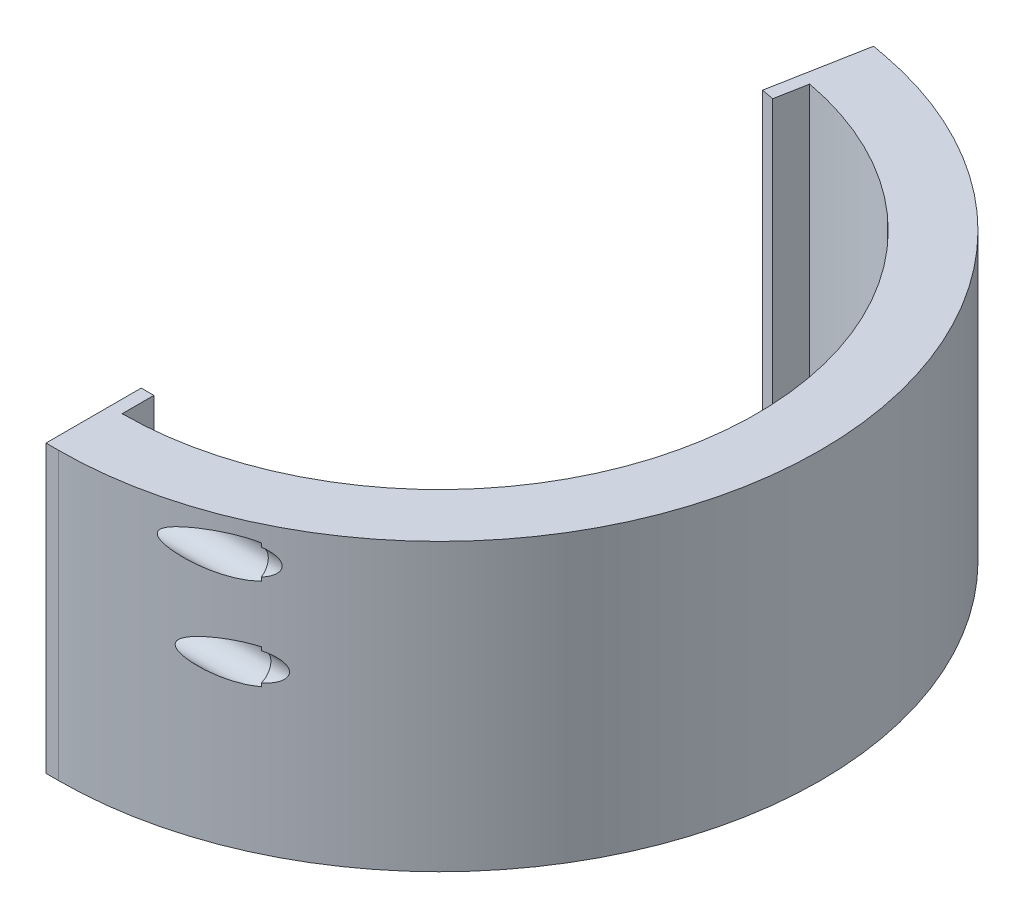
from build123d import *

# Parameters (mm, degrees)
BOSS_EXTRUDE1_DEPTH     = 27.94
CUT_EXTRUDE1_DEPTH      = 62.500004065
CUT_EXTRUDE1_DEPTH_BACK = 62.500004065
SKETCH2_R               = 1.5
SKETCH2_R_2             = 1.554918768
SKETCH2_R_3             = 1.519223358
SKETCH2_3_R             = 1.8175
SKETCH2_3_R_2           = 1.5
SKETCH2_3_R_3           = 1.872418768
SKETCH2_3_R_4           = 1.554918768
SKETCH2_3_R_5           = 1.836723358
SKETCH2_3_R_6           = 1.519223358
CUT_EXTRUDE2_DEPTH      = 17.78
BOSS_EXTRUDE2_START     = -0.6858
BOSS_EXTRUDE2_DEPTH     = 0.6858


with BuildPart() as part:
    # Sketch1 → Boss-Extrude1 (new body)
    with BuildSketch(Plane(origin=(0, 0, 0), x_dir=(1, 0, 0), z_dir=(0, 1, 0))):
        with BuildLine():
            ThreePointArc((63.210725521, -38.1), (101.148320659, -3.514096627), (70.208960434, 37.451765087))
            Line((70.208960434, 37.451765087), (68.960568265, 37.685039584))
            Line((68.960568265, 37.685039584), (67.211009536, 28.322098312))
            Line((67.211009536, 28.322098312), (68.459401706, 28.088823815))
            Line((68.459401706, 28.088823815), (69.042587949, 31.209804239))
            ThreePointArc((69.042587949, 31.209804239), (72.134335795, 30.470176889), (75.136623327, 29.425082184))
            ThreePointArc((75.136623327, 29.425082184), (94.374076266, -6.075201259), (63.210725521, -31.75))
            Line((63.210725521, -31.75), (63.210725521, -28.575))
            Line((63.210725521, -28.575), (61.940725521, -28.575))
            Line((61.940725521, -28.575), (61.940725521, -38.1))
            Line((61.940725521, -38.1), (63.210725521, -38.1))
        make_face()
    extrude(amount=BOSS_EXTRUDE1_DEPTH)

    # Sketch2 → Cut-Extrude1 (cut, two sides: drawn at the far end of the back side and taken through both)
    with BuildSketch(Plane.ZY.offset(-61.940725521).offset(-CUT_EXTRUDE1_DEPTH_BACK)):
        with Locations((34.877492102, 15.559033415)):
            Circle(SKETCH2_R)
        with Locations((35.191543991, 24.633934205)):
            Circle(SKETCH2_R_2)
        with Locations((-35.170796856, 24.633934205)):
            Circle(SKETCH2_R_3)
        with Locations((-35.170796856, 15.364007333)):
            Circle(SKETCH2_R)
    extrude(amount=CUT_EXTRUDE1_DEPTH + CUT_EXTRUDE1_DEPTH_BACK, mode=Mode.SUBTRACT)

    # Sketch2<3> → Cut-Extrude2 (cut)
    # profile 1 of 4: a face of its own
    with BuildSketch(Plane.ZY.offset(-61.940725521)):
        with Locations((34.877492102, 15.559033415)):
            Circle(SKETCH2_3_R)
        with Locations((34.877492102, 15.559033415)):
            Circle(SKETCH2_3_R_2, mode=Mode.SUBTRACT)
    # profile 2 of 4: a face of its own
    with BuildSketch(Plane.ZY.offset(-61.940725521)):
        with Locations((35.191543991, 24.633934205)):
            Circle(SKETCH2_3_R_3)
        with Locations((35.191543991, 24.633934205)):
            Circle(SKETCH2_3_R_4, mode=Mode.SUBTRACT)
    # profile 3 of 4: a face of its own
    with BuildSketch(Plane.ZY.offset(-61.940725521)):
        with Locations((-35.170796856, 24.633934205)):
            Circle(SKETCH2_3_R_5)
        with Locations((-35.170796856, 24.633934205)):
            Circle(SKETCH2_3_R_6, mode=Mode.SUBTRACT)
    # profile 4 of 4: a face of its own
    with BuildSketch(Plane.ZY.offset(-61.940725521)):
        with Locations((-35.170796856, 15.364007333)):
            Circle(SKETCH2_3_R)
        with Locations((-35.170796856, 15.364007333)):
            Circle(SKETCH2_3_R_2, mode=Mode.SUBTRACT)
    extrude(amount=-CUT_EXTRUDE2_DEPTH, mode=Mode.SUBTRACT)

    # Sketch1<2> → Boss-Extrude2 (add)
    with BuildSketch(Plane(origin=(0, 0, 0), x_dir=(1, 0, 0), z_dir=(0, 1, 0)).offset(BOSS_EXTRUDE2_START)):
        with BuildLine():
            ThreePointArc((63.210725521, -38.1), (101.148320659, -3.514096627), (70.208960434, 37.451765087))
            Line((70.208960434, 37.451765087), (68.960568265, 37.685039584))
            Line((68.960568265, 37.685039584), (67.211009536, 28.322098312))
            Line((67.211009536, 28.322098312), (68.459401706, 28.088823815))
            Line((68.459401706, 28.088823815), (69.042587949, 31.209804239))
            ThreePointArc((69.042587949, 31.209804239), (72.134335795, 30.470176889), (75.136623327, 29.425082184))
            ThreePointArc((75.136623327, 29.425082184), (94.374076266, -6.075201259), (63.210725521, -31.75))
            Line((63.210725521, -31.75), (63.210725521, -28.575))
            Line((63.210725521, -28.575), (61.940725521, -28.575))
            Line((61.940725521, -28.575), (61.940725521, -38.1))
            Line((61.940725521, -38.1), (63.210725521, -38.1))
        make_face()
    extrude(amount=BOSS_EXTRUDE2_DEPTH)


solid = part.part
